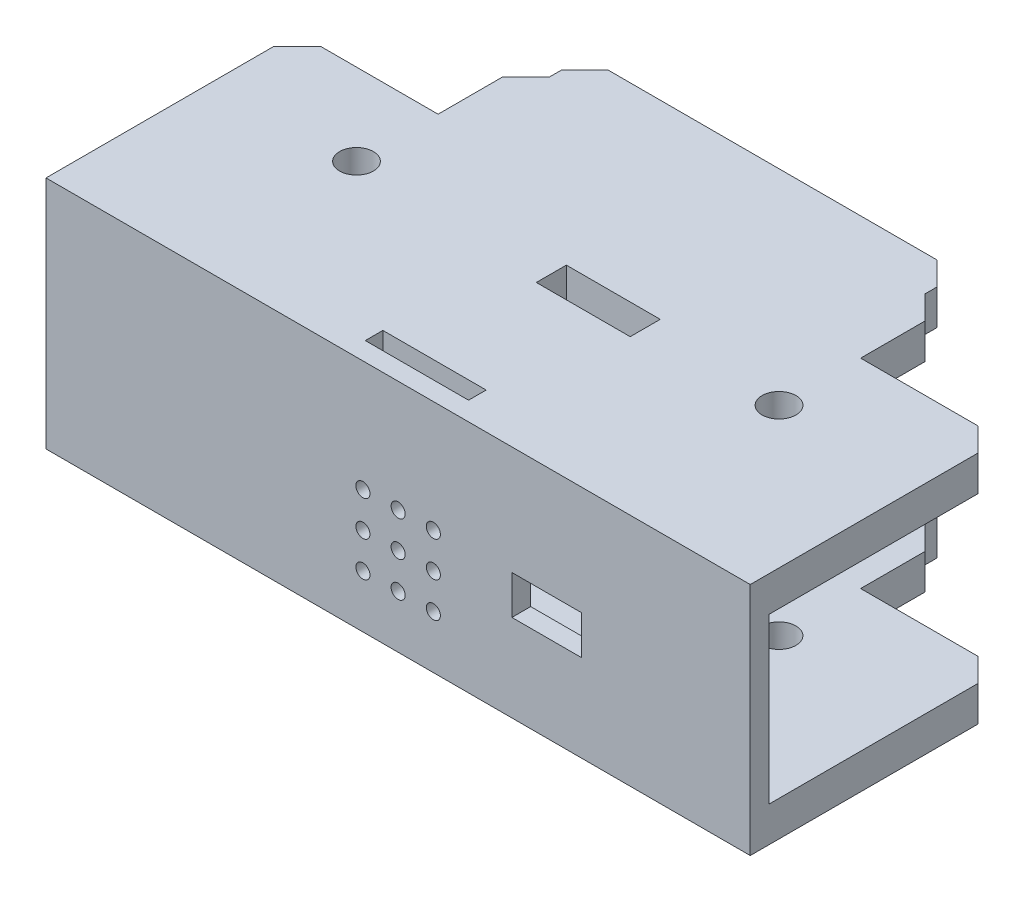
from build123d import *

# Parameters (mm, degrees)
SKETCH1_W           = 150
SKETCH1_H           = 72.26
BOSS_EXTRUDE1_DEPTH = 50
SKETCH2_R           = 3.6
CUT_EXTRUDE1_DEPTH  = 50
SKETCH3_W           = 30
SKETCH3_H           = 50
CUT_EXTRUDE2_DEPTH  = 18.75
CHAMFER1_SIZE       = 5
SKETCH4_W           = 80
SKETCH4_H           = 7.5
BOSS_EXTRUDE2_DEPTH = 7.5
CHAMFER2_SIZE       = 5
SKETCH5_W           = 150
SKETCH5_H           = 35
CUT_EXTRUDE3_DEPTH  = 68.26
SKETCH10_R          = 1.5
CUT_EXTRUDE4_DEPTH  = 4
SKETCH11_W          = 22
SKETCH11_H          = 3.75
CUT_EXTRUDE5_DEPTH  = 50
SKETCH13_W          = 80
SKETCH13_H          = 7.5
BOSS_EXTRUDE3_DEPTH = 7.5
SKETCH14_R          = 1.5
CUT_EXTRUDE6_DEPTH  = 7.5
CHAMFER3_SIZE       = 5
SKETCH19_W          = 20
SKETCH19_H          = 6.4
CUT_EXTRUDE10_DEPTH = 10
SKETCH20_W          = 14.825220809
SKETCH20_H          = 8.289370775
CUT_EXTRUDE11_DEPTH = 9
SKETCH21_W          = 20
SKETCH21_H          = 6.4
CUT_EXTRUDE12_DEPTH = 10


with BuildPart() as part:
    # Sketch1 → Boss-Extrude1 (new body)
    with BuildSketch(Plane(origin=(0, 0, 0), x_dir=(1, 0, 0), z_dir=(0, 1, 0))):
        Rectangle(SKETCH1_W, SKETCH1_H)
    extrude(amount=BOSS_EXTRUDE1_DEPTH)

    # Sketch2 → Cut-Extrude1 (cut)
    with BuildSketch(Plane(origin=(0, 50, 0), x_dir=(1, 0, 0), z_dir=(0, 1, 0))):
        with Locations(Location((-45, 0, 0), (0, 0, 270))):
            Circle(SKETCH2_R)
        with Locations(Location((45, 0, 0), (0, 0, 270))):
            Circle(SKETCH2_R)
    extrude(amount=-CUT_EXTRUDE1_DEPTH, mode=Mode.SUBTRACT)

    # Sketch3 → Cut-Extrude2 (cut)
    with BuildSketch(Plane(origin=(0, 0, -36.13), x_dir=(-1, 0, 0), z_dir=(0, 0, -1))):
        with Locations((60, 25)):
            Rectangle(SKETCH3_W, SKETCH3_H)
        with Locations((-60, 25)):
            Rectangle(SKETCH3_W, SKETCH3_H)
    extrude(amount=-CUT_EXTRUDE2_DEPTH, mode=Mode.SUBTRACT)

    # Chamfer1
    chamfer1_edges = [part.edges().sort_by_distance(p)[0] for p in [
        (-75, 25, -17.38),
        (-45, 25, -36.13),
        (75, 25, -17.38),
        (45, 25, -36.13),
    ]]
    chamfer(chamfer1_edges, length=CHAMFER1_SIZE)

    # Sketch4 → Boss-Extrude2 (add)
    with BuildSketch(Plane(origin=(0, 0, -36.13), x_dir=(-1, 0, 0), z_dir=(0, 0, -1))):
        with Locations((0, 46.25)):
            Rectangle(SKETCH4_W, SKETCH4_H)
    extrude(amount=BOSS_EXTRUDE2_DEPTH)

    # Chamfer2
    chamfer2_edges = [part.edges().sort_by_distance(p)[0] for p in [
        (40, 46.25, -43.63),
        (-40, 46.25, -43.63),
    ]]
    chamfer(chamfer2_edges, length=CHAMFER2_SIZE)

    # Sketch5 → Cut-Extrude3 (cut)
    with BuildSketch(Plane(origin=(0, 0, -36.13), x_dir=(-1, 0, 0), z_dir=(0, 0, -1))):
        with Locations((0, 25)):
            Rectangle(SKETCH5_W, SKETCH5_H)
    extrude(amount=-CUT_EXTRUDE3_DEPTH, mode=Mode.SUBTRACT)

    # Sketch10 → Cut-Extrude4 (cut)
    with BuildSketch(Plane.XY.offset(36.13)):
        with Locations((0, 26.25)):
            Circle(SKETCH10_R)
        with Locations((0, 18.75)):
            Circle(SKETCH10_R)
        with Locations((0, 11.25)):
            Circle(SKETCH10_R)
        with Locations((-7.5, 26.25)):
            Circle(SKETCH10_R)
        with Locations((-7.5, 18.75)):
            Circle(SKETCH10_R)
        with Locations((-7.5, 11.25)):
            Circle(SKETCH10_R)
        with Locations((7.5, 26.25)):
            Circle(SKETCH10_R)
        with Locations((7.5, 18.75)):
            Circle(SKETCH10_R)
        with Locations((7.5, 11.25)):
            Circle(SKETCH10_R)
    extrude(amount=-CUT_EXTRUDE4_DEPTH, mode=Mode.SUBTRACT)

    # Sketch11 → Cut-Extrude5 (cut)
    with BuildSketch(Plane(origin=(0, 50, 0), x_dir=(1, 0, 0), z_dir=(0, 1, 0))):
        with Locations((0, -30.255)):
            Rectangle(SKETCH11_W, SKETCH11_H)
    extrude(amount=-CUT_EXTRUDE5_DEPTH, mode=Mode.SUBTRACT)

    # Sketch13 → Boss-Extrude3 (add)
    with BuildSketch(Plane(origin=(0, 0, -36.13), x_dir=(-1, 0, 0), z_dir=(0, 0, -1))):
        with Locations((0, 3.75)):
            Rectangle(SKETCH13_W, SKETCH13_H)
    extrude(amount=BOSS_EXTRUDE3_DEPTH)

    # Sketch14 → Cut-Extrude6 (cut)
    with BuildSketch(Plane(origin=(0, 0, -43.63), x_dir=(-1, 0, 0), z_dir=(0, 0, -1))):
        with Locations((-15, 3.75)):
            Circle(SKETCH14_R)
        with Locations((15, 3.75)):
            Circle(SKETCH14_R)
    extrude(amount=-CUT_EXTRUDE6_DEPTH, mode=Mode.SUBTRACT)

    # Chamfer3
    chamfer3_edges = [part.edges().sort_by_distance(p)[0] for p in [
        (40, 3.75, -43.63),
        (-40, 3.75, -43.63),
    ]]
    chamfer(chamfer3_edges, length=CHAMFER3_SIZE)

    # Sketch19 → Cut-Extrude10 (cut)
    with BuildSketch(Plane(origin=(0, 50, 0), x_dir=(1, 0, 0), z_dir=(0, 1, 0))):
        with Locations((6.5, 0)):
            Rectangle(SKETCH19_W, SKETCH19_H)
    extrude(amount=-CUT_EXTRUDE10_DEPTH, mode=Mode.SUBTRACT)

    # Sketch20 → Cut-Extrude11 (cut)
    with BuildSketch(Plane.XY.offset(36.13)):
        with Locations((31.643078824, 22.688540842)):
            Rectangle(SKETCH20_W, SKETCH20_H)
    extrude(amount=-CUT_EXTRUDE11_DEPTH, mode=Mode.SUBTRACT)

    # Sketch21 → Cut-Extrude12 (cut)
    with BuildSketch(Plane.XZ):
        with Locations((-6.5, 0)):
            Rectangle(SKETCH21_W, SKETCH21_H)
    extrude(amount=-CUT_EXTRUDE12_DEPTH, mode=Mode.SUBTRACT)


solid = part.part
